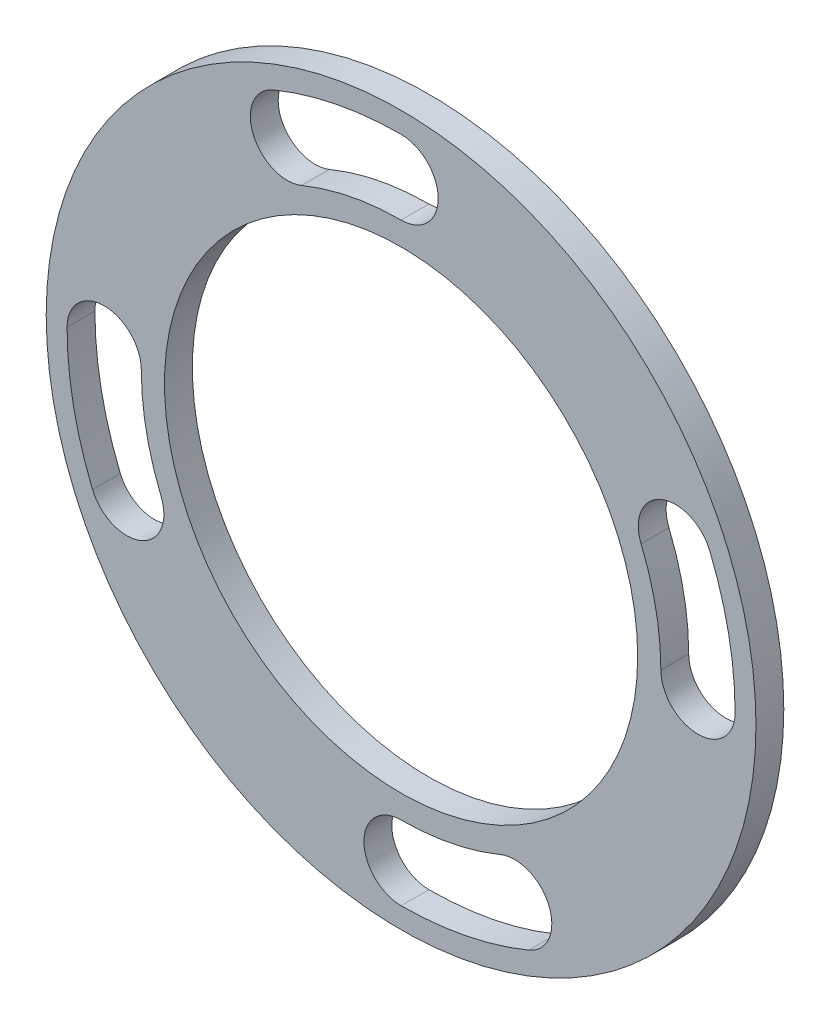
from build123d import *

# Parameters (mm, degrees)
SKETCH1_R           = 7.65
SKETCH1_R_2         = 5.1
BOSS_EXTRUDE1_DEPTH = 0.6


with BuildPart() as part:
    # Sketch1 → Boss-Extrude1 (new body)
    with BuildSketch(Plane.XY):
        Circle(SKETCH1_R)
        Circle(SKETCH1_R_2, mode=Mode.SUBTRACT)
        with BuildLine():
            ThreePointArc((0, 5.6), (0.8, 6.4), (0, 7.2))
            ThreePointArc((0, 7.2), (-1.404650319, 7.061654019), (-2.755320713, 6.651932634))
            ThreePointArc((-2.755320713, 6.651932634), (-3.188277593, 5.606682262), (-2.143027221, 5.173725382))
            ThreePointArc((-2.143027221, 5.173725382), (-1.092505803, 5.49239757), (0, 5.6))
        make_face(mode=Mode.SUBTRACT)
        with BuildLine():
            ThreePointArc((6.651932634, 2.755320713), (5.606682262, 3.188277593), (5.173725382, 2.143027221))
            ThreePointArc((5.173725382, 2.143027221), (5.49239757, 1.092505803), (5.6, 0))
            ThreePointArc((5.6, 0), (6.4, -0.8), (7.2, 0))
            ThreePointArc((7.2, 0), (7.061654019, 1.404650319), (6.651932634, 2.755320713))
        make_face(mode=Mode.SUBTRACT)
        with BuildLine():
            ThreePointArc((2.755320713, -6.651932634), (3.188277593, -5.606682262), (2.143027221, -5.173725382))
            ThreePointArc((2.143027221, -5.173725382), (1.092505803, -5.49239757), (0, -5.6))
            ThreePointArc((0, -5.6), (-0.8, -6.4), (0, -7.2))
            ThreePointArc((0, -7.2), (1.404650319, -7.061654019), (2.755320713, -6.651932634))
        make_face(mode=Mode.SUBTRACT)
        with BuildLine():
            ThreePointArc((-6.651932634, -2.755320713), (-5.606682262, -3.188277593), (-5.173725382, -2.143027221))
            ThreePointArc((-5.173725382, -2.143027221), (-5.49239757, -1.092505803), (-5.6, 0))
            ThreePointArc((-5.6, 0), (-6.4, 0.8), (-7.2, 0))
            ThreePointArc((-7.2, 0), (-7.061654019, -1.404650319), (-6.651932634, -2.755320713))
        make_face(mode=Mode.SUBTRACT)
    extrude(amount=BOSS_EXTRUDE1_DEPTH)


solid = part.part
